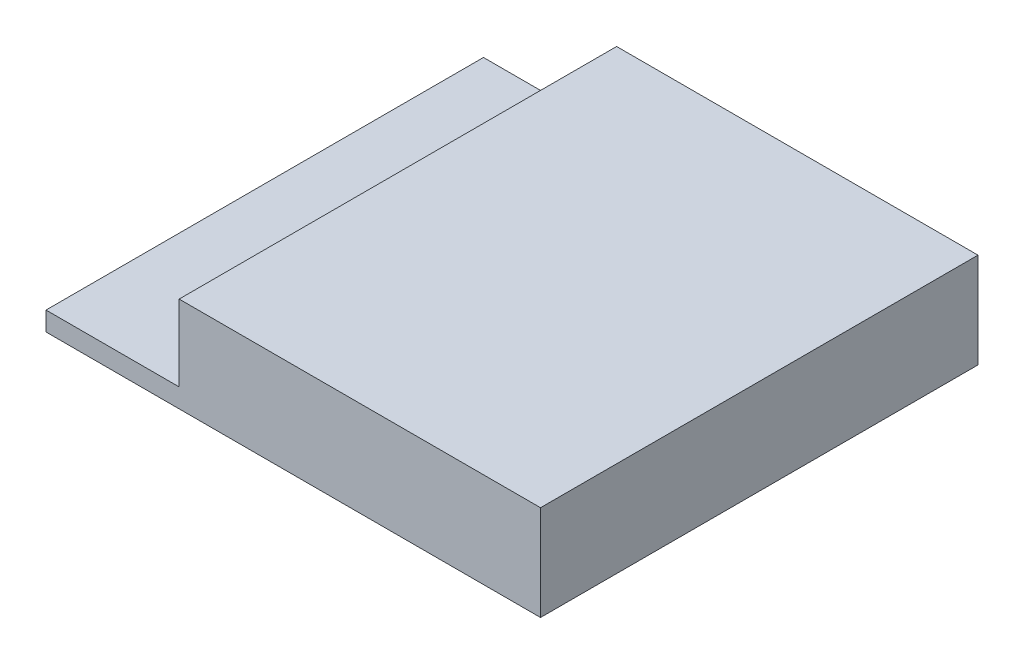
from build123d import *

# Parameters (mm, degrees)
SKETCH1_W           = 26
SKETCH1_H           = 23
BOSS_EXTRUDE1_DEPTH = 5
SKETCH2_W           = 7
SKETCH2_H           = 23
CUT_EXTRUDE1_DEPTH  = 4


with BuildPart() as part:
    # Sketch1 → Boss-Extrude1 (new body)
    with BuildSketch(Plane(origin=(0, 0, 0), x_dir=(1, 0, 0), z_dir=(0, 1, 0))):
        with Locations((-1.801980198, -21.861386139)):
            Rectangle(SKETCH1_W, SKETCH1_H)
    extrude(amount=BOSS_EXTRUDE1_DEPTH)

    # Sketch2 → Cut-Extrude1 (cut)
    with BuildSketch(Plane(origin=(0, 5, 0), x_dir=(1, 0, 0), z_dir=(0, 1, 0))):
        with Locations((-11.301980198, -21.861386139)):
            Rectangle(SKETCH2_W, SKETCH2_H)
    extrude(amount=-CUT_EXTRUDE1_DEPTH, mode=Mode.SUBTRACT)


solid = part.part
